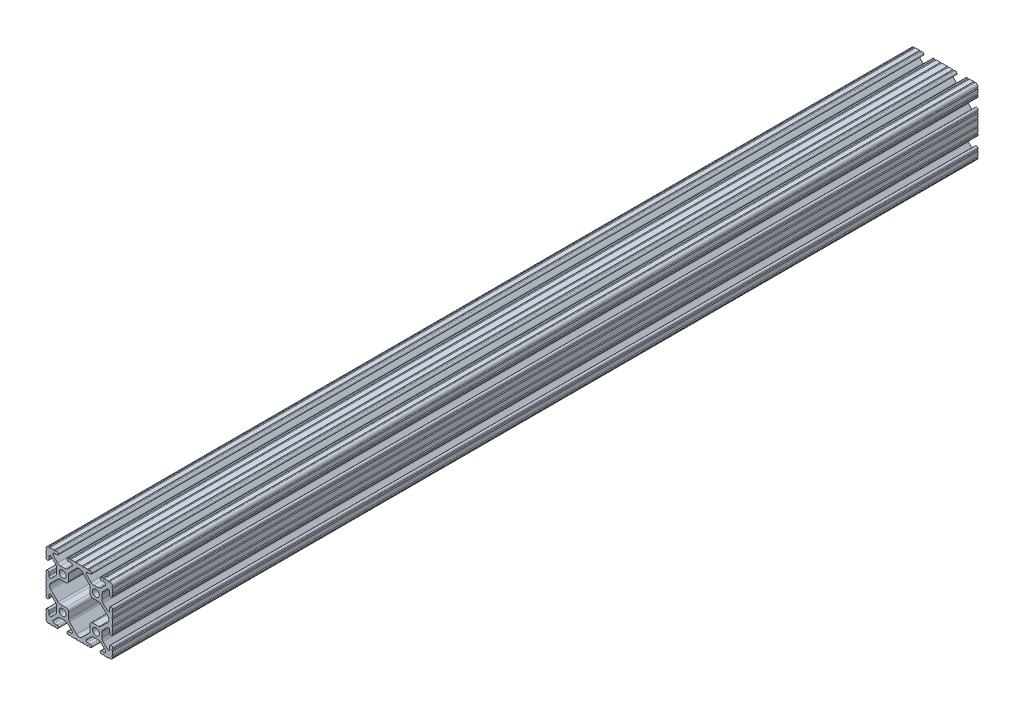
from build123d import *

# Parameters (mm, degrees)
SKETCH1_R      = 2.6035
EXTRUDE1_DEPTH = 330.2


with BuildPart() as part:
    # Sketch1 → Extrude1 (new, symmetric)
    with BuildSketch(Plane.XY):
        with BuildLine():
            Line((-2.1336, -25.4), (2.1336, -25.4))
            ThreePointArc((2.1336, -25.4), (2.6416, -24.892), (3.1496, -25.4))
            Line((3.1496, -25.4), (6.3754, -25.4))
            ThreePointArc((6.3754, -25.4), (6.8834, -24.892), (7.3914, -25.4))
            Line((7.3914, -25.4), (8.3439, -25.4))
            ThreePointArc((8.3439, -25.4), (9.4488, -24.2951), (8.3439, -23.1902))
            Line((8.3439, -23.1902), (6.225205544, -23.1902))
            ThreePointArc((6.225205544, -23.1902), (5.286543939, -22.563006367), (5.506785055, -21.45577951))
            Line((5.506785055, -21.45577951), (8.824128595, -18.13843597))
            ThreePointArc((8.824128595, -18.13843597), (9.854172728, -17.450182484), (11.069192626, -17.2085))
            Line((11.069192626, -17.2085), (14.330807374, -17.2085))
            ThreePointArc((14.330807374, -17.2085), (15.545827272, -17.450182484), (16.575871405, -18.13843597))
            Line((16.575871405, -18.13843597), (19.893214945, -21.45577951))
            ThreePointArc((19.893214945, -21.45577951), (20.113456061, -22.563006367), (19.174794456, -23.1902))
            Line((19.174794456, -23.1902), (17.0561, -23.1902))
            ThreePointArc((17.0561, -23.1902), (15.9512, -24.2951), (17.0561, -25.4))
            Line((17.0561, -25.4), (18.0086, -25.4))
            ThreePointArc((18.0086, -25.4), (18.5166, -24.892), (19.0246, -25.4))
            Line((19.0246, -25.4), (22.2504, -25.4))
            ThreePointArc((22.2504, -25.4), (22.7584, -24.892), (23.2664, -25.4))
            Line((23.2664, -25.4), (23.2918, -25.4))
            ThreePointArc((23.2918, -25.4), (24.782522516, -24.782522516), (25.4, -23.2918))
            Line((25.4, -23.2918), (25.4, -23.2664))
            ThreePointArc((25.4, -23.2664), (24.892, -22.7584), (25.4, -22.2504))
            Line((25.4, -22.2504), (25.4, -19.0246))
            ThreePointArc((25.4, -19.0246), (24.892, -18.5166), (25.4, -18.0086))
            Line((25.4, -18.0086), (25.4, -17.0561))
            ThreePointArc((25.4, -17.0561), (24.2951, -15.9512), (23.1902, -17.0561))
            Line((23.1902, -17.0561), (23.1902, -19.174794456))
            ThreePointArc((23.1902, -19.174794456), (22.563006367, -20.113456061), (21.45577951, -19.893214945))
            Line((21.45577951, -19.893214945), (18.13843597, -16.575871405))
            ThreePointArc((18.13843597, -16.575871405), (17.450182484, -15.545827272), (17.2085, -14.330807374))
            Line((17.2085, -14.330807374), (17.2085, -11.069192626))
            ThreePointArc((17.2085, -11.069192626), (17.450182484, -9.854172728), (18.13843597, -8.824128595))
            Line((18.13843597, -8.824128595), (21.45577951, -5.506785055))
            ThreePointArc((21.45577951, -5.506785055), (22.563006367, -5.286543939), (23.1902, -6.225205544))
            Line((23.1902, -6.225205544), (23.1902, -8.3439))
            ThreePointArc((23.1902, -8.3439), (24.2951, -9.4488), (25.4, -8.3439))
            Line((25.4, -8.3439), (25.4, -7.3914))
            ThreePointArc((25.4, -7.3914), (24.892, -6.8834), (25.4, -6.3754))
            Line((25.4, -6.3754), (25.4, -3.1496))
            ThreePointArc((25.4, -3.1496), (24.892, -2.6416), (25.4, -2.1336))
            Line((25.4, -2.1336), (25.4, 2.1336))
            ThreePointArc((25.4, 2.1336), (24.892, 2.6416), (25.4, 3.1496))
            Line((25.4, 3.1496), (25.4, 6.3754))
            ThreePointArc((25.4, 6.3754), (24.892, 6.8834), (25.4, 7.3914))
            Line((25.4, 7.3914), (25.4, 8.3439))
            ThreePointArc((25.4, 8.3439), (24.2951, 9.4488), (23.1902, 8.3439))
            Line((23.1902, 8.3439), (23.1902, 6.225205544))
            ThreePointArc((23.1902, 6.225205544), (22.563006367, 5.286543939), (21.45577951, 5.506785055))
            Line((21.45577951, 5.506785055), (18.13843597, 8.824128595))
            ThreePointArc((18.13843597, 8.824128595), (17.450182484, 9.854172728), (17.2085, 11.069192626))
            Line((17.2085, 11.069192626), (17.2085, 14.330807374))
            ThreePointArc((17.2085, 14.330807374), (17.450182484, 15.545827272), (18.13843597, 16.575871405))
            Line((18.13843597, 16.575871405), (21.45577951, 19.893214945))
            ThreePointArc((21.45577951, 19.893214945), (22.563006367, 20.113456061), (23.1902, 19.174794456))
            Line((23.1902, 19.174794456), (23.1902, 17.0561))
            ThreePointArc((23.1902, 17.0561), (24.2951, 15.9512), (25.4, 17.0561))
            Line((25.4, 17.0561), (25.4, 18.0086))
            ThreePointArc((25.4, 18.0086), (24.892, 18.5166), (25.4, 19.0246))
            Line((25.4, 19.0246), (25.4, 22.2504))
            ThreePointArc((25.4, 22.2504), (24.892, 22.7584), (25.4, 23.2664))
            Line((25.4, 23.2664), (25.4, 23.2918))
            ThreePointArc((25.4, 23.2918), (24.782522516, 24.782522516), (23.2918, 25.4))
            Line((23.2918, 25.4), (23.2664, 25.4))
            ThreePointArc((23.2664, 25.4), (22.7584, 24.892), (22.2504, 25.4))
            Line((22.2504, 25.4), (19.0246, 25.4))
            ThreePointArc((19.0246, 25.4), (18.5166, 24.892), (18.0086, 25.4))
            Line((18.0086, 25.4), (17.0561, 25.4))
            ThreePointArc((17.0561, 25.4), (15.9512, 24.2951), (17.0561, 23.1902))
            Line((17.0561, 23.1902), (19.174794456, 23.1902))
            ThreePointArc((19.174794456, 23.1902), (20.113456061, 22.563006367), (19.893214945, 21.45577951))
            Line((19.893214945, 21.45577951), (16.575871405, 18.13843597))
            ThreePointArc((16.575871405, 18.13843597), (15.545827272, 17.450182484), (14.330807374, 17.2085))
            Line((14.330807374, 17.2085), (11.069192626, 17.2085))
            ThreePointArc((11.069192626, 17.2085), (9.854172728, 17.450182484), (8.824128595, 18.13843597))
            Line((8.824128595, 18.13843597), (5.506785055, 21.45577951))
            ThreePointArc((5.506785055, 21.45577951), (5.286543939, 22.563006367), (6.225205544, 23.1902))
            Line((6.225205544, 23.1902), (8.3439, 23.1902))
            ThreePointArc((8.3439, 23.1902), (9.4488, 24.2951), (8.3439, 25.4))
            Line((8.3439, 25.4), (7.3914, 25.4))
            ThreePointArc((7.3914, 25.4), (6.8834, 24.892), (6.3754, 25.4))
            Line((6.3754, 25.4), (3.1496, 25.4))
            ThreePointArc((3.1496, 25.4), (2.6416, 24.892), (2.1336, 25.4))
            Line((2.1336, 25.4), (-2.1336, 25.4))
            ThreePointArc((-2.1336, 25.4), (-2.6416, 24.892), (-3.1496, 25.4))
            Line((-3.1496, 25.4), (-6.3754, 25.4))
            ThreePointArc((-6.3754, 25.4), (-6.8834, 24.892), (-7.3914, 25.4))
            Line((-7.3914, 25.4), (-8.3439, 25.4))
            ThreePointArc((-8.3439, 25.4), (-9.4488, 24.2951), (-8.3439, 23.1902))
            Line((-8.3439, 23.1902), (-6.225205544, 23.1902))
            ThreePointArc((-6.225205544, 23.1902), (-5.286543939, 22.563006367), (-5.506785055, 21.45577951))
            Line((-5.506785055, 21.45577951), (-8.824128595, 18.13843597))
            ThreePointArc((-8.824128595, 18.13843597), (-9.854172728, 17.450182484), (-11.069192626, 17.2085))
            Line((-11.069192626, 17.2085), (-14.330807374, 17.2085))
            ThreePointArc((-14.330807374, 17.2085), (-15.545827272, 17.450182484), (-16.575871405, 18.13843597))
            Line((-16.575871405, 18.13843597), (-19.893214945, 21.45577951))
            ThreePointArc((-19.893214945, 21.45577951), (-20.113456061, 22.563006367), (-19.174794456, 23.1902))
            Line((-19.174794456, 23.1902), (-17.0561, 23.1902))
            ThreePointArc((-17.0561, 23.1902), (-15.9512, 24.2951), (-17.0561, 25.4))
            Line((-17.0561, 25.4), (-18.0086, 25.4))
            ThreePointArc((-18.0086, 25.4), (-18.5166, 24.892), (-19.0246, 25.4))
            Line((-19.0246, 25.4), (-22.2504, 25.4))
            ThreePointArc((-22.2504, 25.4), (-22.7584, 24.892), (-23.2664, 25.4))
            Line((-23.2664, 25.4), (-23.2918, 25.4))
            ThreePointArc((-23.2918, 25.4), (-24.782522516, 24.782522516), (-25.4, 23.2918))
            Line((-25.4, 23.2918), (-25.4, 23.2664))
            ThreePointArc((-25.4, 23.2664), (-24.892, 22.7584), (-25.4, 22.2504))
            Line((-25.4, 22.2504), (-25.4, 19.0246))
            ThreePointArc((-25.4, 19.0246), (-24.892, 18.5166), (-25.4, 18.0086))
            Line((-25.4, 18.0086), (-25.4, 17.0561))
            ThreePointArc((-25.4, 17.0561), (-24.2951, 15.9512), (-23.1902, 17.0561))
            Line((-23.1902, 17.0561), (-23.1902, 19.174794456))
            ThreePointArc((-23.1902, 19.174794456), (-22.563006367, 20.113456061), (-21.45577951, 19.893214945))
            Line((-21.45577951, 19.893214945), (-18.13843597, 16.575871405))
            ThreePointArc((-18.13843597, 16.575871405), (-17.450182484, 15.545827272), (-17.2085, 14.330807374))
            Line((-17.2085, 14.330807374), (-17.2085, 11.069192626))
            ThreePointArc((-17.2085, 11.069192626), (-17.450182484, 9.854172728), (-18.13843597, 8.824128595))
            Line((-18.13843597, 8.824128595), (-21.45577951, 5.506785055))
            ThreePointArc((-21.45577951, 5.506785055), (-22.563006367, 5.286543939), (-23.1902, 6.225205544))
            Line((-23.1902, 6.225205544), (-23.1902, 8.3439))
            ThreePointArc((-23.1902, 8.3439), (-24.2951, 9.4488), (-25.4, 8.3439))
            Line((-25.4, 8.3439), (-25.4, 7.3914))
            ThreePointArc((-25.4, 7.3914), (-24.892, 6.8834), (-25.4, 6.3754))
            Line((-25.4, 6.3754), (-25.4, 3.1496))
            ThreePointArc((-25.4, 3.1496), (-24.892, 2.6416), (-25.4, 2.1336))
            Line((-25.4, 2.1336), (-25.4, -2.1336))
            ThreePointArc((-25.4, -2.1336), (-24.892, -2.6416), (-25.4, -3.1496))
            Line((-25.4, -3.1496), (-25.4, -6.3754))
            ThreePointArc((-25.4, -6.3754), (-24.892, -6.8834), (-25.4, -7.3914))
            Line((-25.4, -7.3914), (-25.4, -8.3439))
            ThreePointArc((-25.4, -8.3439), (-24.2951, -9.4488), (-23.1902, -8.3439))
            Line((-23.1902, -8.3439), (-23.1902, -6.225205544))
            ThreePointArc((-23.1902, -6.225205544), (-22.563006367, -5.286543939), (-21.45577951, -5.506785055))
            Line((-21.45577951, -5.506785055), (-18.13843597, -8.824128595))
            ThreePointArc((-18.13843597, -8.824128595), (-17.450182484, -9.854172728), (-17.2085, -11.069192626))
            Line((-17.2085, -11.069192626), (-17.2085, -14.330807374))
            ThreePointArc((-17.2085, -14.330807374), (-17.450182484, -15.545827272), (-18.13843597, -16.575871405))
            Line((-18.13843597, -16.575871405), (-21.45577951, -19.893214945))
            ThreePointArc((-21.45577951, -19.893214945), (-22.563006367, -20.113456061), (-23.1902, -19.174794456))
            Line((-23.1902, -19.174794456), (-23.1902, -17.0561))
            ThreePointArc((-23.1902, -17.0561), (-24.2951, -15.9512), (-25.4, -17.0561))
            Line((-25.4, -17.0561), (-25.4, -18.0086))
            ThreePointArc((-25.4, -18.0086), (-24.892, -18.5166), (-25.4, -19.0246))
            Line((-25.4, -19.0246), (-25.4, -22.2504))
            ThreePointArc((-25.4, -22.2504), (-24.892, -22.7584), (-25.4, -23.2664))
            Line((-25.4, -23.2664), (-25.4, -23.2918))
            ThreePointArc((-25.4, -23.2918), (-24.782522516, -24.782522516), (-23.2918, -25.4))
            Line((-23.2918, -25.4), (-23.2664, -25.4))
            ThreePointArc((-23.2664, -25.4), (-22.7584, -24.892), (-22.2504, -25.4))
            Line((-22.2504, -25.4), (-19.0246, -25.4))
            ThreePointArc((-19.0246, -25.4), (-18.5166, -24.892), (-18.0086, -25.4))
            Line((-18.0086, -25.4), (-17.0561, -25.4))
            ThreePointArc((-17.0561, -25.4), (-15.9512, -24.2951), (-17.0561, -23.1902))
            Line((-17.0561, -23.1902), (-19.174794456, -23.1902))
            ThreePointArc((-19.174794456, -23.1902), (-20.113456061, -22.563006367), (-19.893214945, -21.45577951))
            Line((-19.893214945, -21.45577951), (-16.575871405, -18.13843597))
            ThreePointArc((-16.575871405, -18.13843597), (-15.545827272, -17.450182484), (-14.330807374, -17.2085))
            Line((-14.330807374, -17.2085), (-11.069192626, -17.2085))
            ThreePointArc((-11.069192626, -17.2085), (-9.854172728, -17.450182484), (-8.824128595, -18.13843597))
            Line((-8.824128595, -18.13843597), (-5.506785055, -21.45577951))
            ThreePointArc((-5.506785055, -21.45577951), (-5.286543939, -22.563006367), (-6.225205544, -23.1902))
            Line((-6.225205544, -23.1902), (-8.3439, -23.1902))
            ThreePointArc((-8.3439, -23.1902), (-9.4488, -24.2951), (-8.3439, -25.4))
            Line((-8.3439, -25.4), (-7.3914, -25.4))
            ThreePointArc((-7.3914, -25.4), (-6.8834, -24.892), (-6.3754, -25.4))
            Line((-6.3754, -25.4), (-3.1496, -25.4))
            ThreePointArc((-3.1496, -25.4), (-2.6416, -24.892), (-2.1336, -25.4))
        make_face()
        with Locations((12.7, 12.7)):
            Circle(SKETCH1_R, mode=Mode.SUBTRACT)
        with Locations((12.7, -12.7)):
            Circle(SKETCH1_R, mode=Mode.SUBTRACT)
        with Locations((-12.7, 12.7)):
            Circle(SKETCH1_R, mode=Mode.SUBTRACT)
        with Locations((-12.7, -12.7)):
            Circle(SKETCH1_R, mode=Mode.SUBTRACT)
        with BuildLine():
            Line((-10.4013, 8.1915), (-14.730606305, 8.1915))
            ThreePointArc((-14.730606305, 8.1915), (-15.576260154, 8.023288991), (-16.29317087, 7.544264565))
            Line((-16.29317087, 7.544264565), (-21.771976527, 2.065458908))
            ThreePointArc((-21.771976527, 2.065458908), (-22.627517619, 0), (-21.771976527, -2.065458908))
            Line((-21.771976527, -2.065458908), (-16.29317087, -7.544264565))
            ThreePointArc((-16.29317087, -7.544264565), (-15.576260154, -8.023288991), (-14.730606305, -8.1915))
            Line((-14.730606305, -8.1915), (-10.4013, -8.1915))
            ThreePointArc((-10.4013, -8.1915), (-8.838735435, -8.838735435), (-8.1915, -10.4013))
            Line((-8.1915, -10.4013), (-8.1915, -14.730606305))
            ThreePointArc((-8.1915, -14.730606305), (-8.023288991, -15.576260154), (-7.544264565, -16.29317087))
            Line((-7.544264565, -16.29317087), (-2.065458908, -21.771976527))
            ThreePointArc((-2.065458908, -21.771976527), (0, -22.627517619), (2.065458908, -21.771976527))
            Line((2.065458908, -21.771976527), (7.544264565, -16.29317087))
            ThreePointArc((7.544264565, -16.29317087), (8.023288991, -15.576260154), (8.1915, -14.730606305))
            Line((8.1915, -14.730606305), (8.1915, -10.4013))
            ThreePointArc((8.1915, -10.4013), (8.838735435, -8.838735435), (10.4013, -8.1915))
            Line((10.4013, -8.1915), (14.730606305, -8.1915))
            ThreePointArc((14.730606305, -8.1915), (15.576260154, -8.023288991), (16.29317087, -7.544264565))
            Line((16.29317087, -7.544264565), (21.771976527, -2.065458908))
            ThreePointArc((21.771976527, -2.065458908), (22.627517619, 0), (21.771976527, 2.065458908))
            Line((21.771976527, 2.065458908), (16.29317087, 7.544264565))
            ThreePointArc((16.29317087, 7.544264565), (15.576260154, 8.023288991), (14.730606305, 8.1915))
            Line((14.730606305, 8.1915), (10.4013, 8.1915))
            ThreePointArc((10.4013, 8.1915), (8.838735435, 8.838735435), (8.1915, 10.4013))
            Line((8.1915, 10.4013), (8.1915, 14.730606305))
            ThreePointArc((8.1915, 14.730606305), (8.023288991, 15.576260154), (7.544264565, 16.29317087))
            Line((7.544264565, 16.29317087), (2.065458908, 21.771976527))
            ThreePointArc((2.065458908, 21.771976527), (0, 22.627517619), (-2.065458908, 21.771976527))
            Line((-2.065458908, 21.771976527), (-7.544264565, 16.29317087))
            ThreePointArc((-7.544264565, 16.29317087), (-8.023288991, 15.576260154), (-8.1915, 14.730606305))
            Line((-8.1915, 14.730606305), (-8.1915, 10.4013))
            ThreePointArc((-8.1915, 10.4013), (-8.838735435, 8.838735435), (-10.4013, 8.1915))
        make_face(mode=Mode.SUBTRACT)
    extrude(amount=EXTRUDE1_DEPTH, both=True)


solid = part.part
